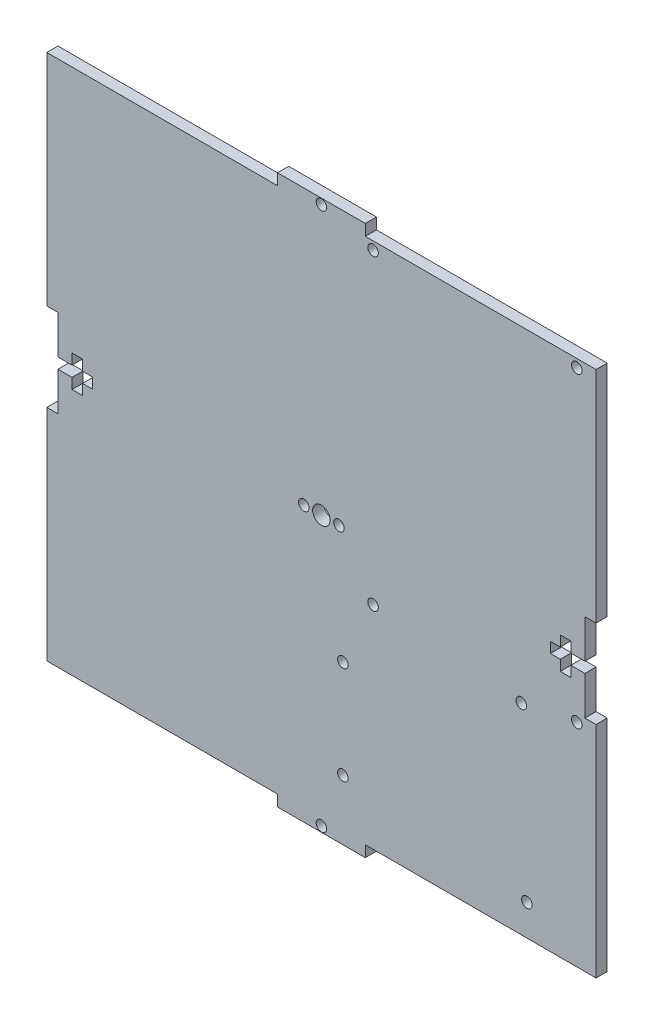
from build123d import *

# Parameters (mm, degrees)
SKETCH1_R           = 1.5
BOSS_EXTRUDE1_DEPTH = 3.18
SKETCH2_R           = 2.5
SKETCH2_R_2         = 1.5
CUT_EXTRUDE1_DEPTH  = 20
SKETCH3_R           = 1.5
CUT_EXTRUDE2_DEPTH  = 20
SKETCH5_R           = 1.5
CUT_EXTRUDE4_DEPTH  = 4


with BuildPart() as part:
    # Sketch1 → Boss-Extrude1 (new body)
    with BuildSketch(Plane.XY):
        Polygon((-78.18, 75), (-12.5, 75), (-12.5, 78.18), (12.5, 78.18), (12.5, 75), (78.18, 75), (78.18, 12.5), (75, 12.5), (75, 1.5), (71, 1.5), (71, 4.5), (68, 4.5), (68, 1.5), (65.18, 1.5), (65.18, -1.5), (68, -1.5), (68, -4.5), (71, -4.5), (71, -1.5), (75, -1.5), (75, -12.5), (78.18, -12.5), (78.18, -75), (12.5, -75), (12.5, -78.18), (-12.5, -78.18), (-12.5, -75), (-78.18, -75), (-78.18, -12.5), (-75, -12.5), (-75, -1.5), (-71, -1.5), (-71, -4.5), (-68, -4.5), (-68, -1.5), (-65.18, -1.5), (-65.18, 1.5), (-68, 1.5), (-68, 4.5), (-71, 4.5), (-71, 1.5), (-75, 1.5), (-75, 12.5), (-78.18, 12.5), align=None)
        with Locations(Location((0, -76.59, 0), (0, 0, 180))):
            Circle(SKETCH1_R, mode=Mode.SUBTRACT)
        with Locations(Location((0, 76.59, 0), (0, 0, 180))):
            Circle(SKETCH1_R, mode=Mode.SUBTRACT)
    extrude(amount=BOSS_EXTRUDE1_DEPTH)

    # Sketch2 → Cut-Extrude1 (cut)
    with BuildSketch(Plane.XY.offset(3.18)):
        Circle(SKETCH2_R)
        with Locations((-5, 0)):
            Circle(SKETCH2_R_2)
        with Locations((5, 0)):
            Circle(SKETCH2_R_2)
    extrude(amount=-CUT_EXTRUDE1_DEPTH, mode=Mode.SUBTRACT)

    # Sketch3 → Cut-Extrude2 (cut)
    with BuildSketch(Plane.XY.offset(3.18)):
        with Locations((56.9, -17.847779645)):
            Circle(SKETCH3_R)
        with Locations((58.5, -66.147779645)):
            Circle(SKETCH3_R)
        with Locations((6.1, -33.147779645)):
            Circle(SKETCH3_R)
        with Locations((6.1, -61.047779645)):
            Circle(SKETCH3_R)
    extrude(amount=-CUT_EXTRUDE2_DEPTH, mode=Mode.SUBTRACT)

    # Sketch5 → Cut-Extrude4 (cut)
    with BuildSketch(Plane.XY.offset(3.18)):
        with Locations((14.702943725, 72.697056275)):
            Circle(SKETCH5_R)
        with Locations((72.697056275, 72.697056275)):
            Circle(SKETCH5_R)
        with Locations((14.702943725, -14.697056275)):
            Circle(SKETCH5_R)
        with Locations((72.697056275, -14.697056275)):
            Circle(SKETCH5_R)
    extrude(amount=-CUT_EXTRUDE4_DEPTH, mode=Mode.SUBTRACT)


solid = part.part
